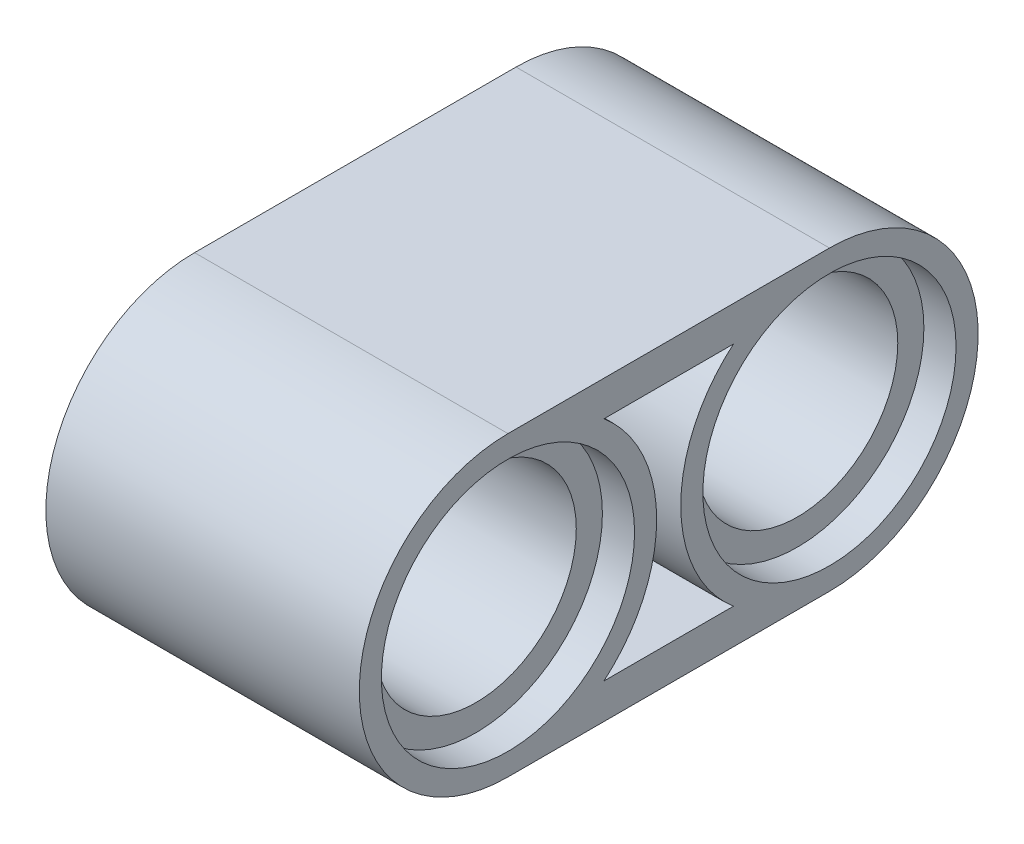
from build123d import *

# Parameters (mm, degrees)
EXTRUDE_1_DEPTH          = 7.8
CUT_EXTRUDE_1_DEPTH      = 12.568059474
CUT_EXTRUDE_1_DEPTH_BACK = 12.568059474
SKETCH_2_3_R             = 2.5
SKETCH_2_6_R             = 3.15
CUT_EXTRUDE_6_DEPTH      = 1
CUT_EXTRUDE_START        = -2
CUT_EXTRUDE_7_DEPTH      = 2
CUT_EXTRUDE_START_2      = -7.8
CUT_EXTRUDE_8_DEPTH      = 2


with BuildPart() as part:
    # 草图2 → 凸台-拉伸1 (new body)
    with BuildSketch(Plane(origin=(0, 0, 0), x_dir=(0, 0, -1), z_dir=(1, 0, 0))):
        with BuildLine():
            Line((-4, 3.7), (4, 3.7))
            ThreePointArc((4, 3.7), (7.7, 0), (4, -3.7))
            Line((4, -3.7), (-4, -3.7))
            ThreePointArc((-4, -3.7), (-7.7, 0), (-4, 3.7))
        make_face()
    extrude(amount=EXTRUDE_1_DEPTH)

    # 草图2<3> → 切除-拉伸1 (cut, two sides: drawn at the far end of the back side and taken through both)
    with BuildSketch(Plane(origin=(0, 0, 0), x_dir=(0, 0, -1), z_dir=(1, 0, 0)).offset(-CUT_EXTRUDE_1_DEPTH_BACK)):
        with Locations((-4, 0)):
            Circle(SKETCH_2_3_R)
        with Locations((4, 0)):
            Circle(SKETCH_2_3_R)
    extrude(amount=CUT_EXTRUDE_1_DEPTH + CUT_EXTRUDE_1_DEPTH_BACK, mode=Mode.SUBTRACT)

    # 草图2<6> → 切除-拉伸6 (cut)
    with BuildSketch(Plane(origin=(0, 0, 0), x_dir=(0, 0, -1), z_dir=(1, 0, 0))):
        with Locations((-4, 0)):
            Circle(SKETCH_2_6_R)
        with Locations((4, 0)):
            Circle(SKETCH_2_6_R)
    cut_extrude_6 = extrude(amount=CUT_EXTRUDE_6_DEPTH, mode=Mode.SUBTRACT)

    # 镜向1: 切除-拉伸6 across plane
    add(cut_extrude_6.mirror(Plane(origin=(4, 0, 0), x_dir=(0, 0, 1), z_dir=(1, 0, 0))), mode=Mode.SUBTRACT)

    # 草图3 → 切除-拉伸7 (cut)
    with BuildSketch(Plane(origin=(7.8, 0, 0), x_dir=(0, 0, -1), z_dir=(1, 0, 0)).offset(CUT_EXTRUDE_START)):
        with BuildLine():
            Line((1.610570152, 2.825), (-1.610570152, 2.825))
            ThreePointArc((-1.610570152, 2.825), (-0.643596386, 1.557098192), (-0.3, 0))
            ThreePointArc((-0.3, 0), (-0.643596386, -1.557098192), (-1.610570152, -2.825))
            Line((-1.610570152, -2.825), (1.610570152, -2.825))
            ThreePointArc((1.610570152, -2.825), (0.3, 0), (1.610570152, 2.825))
        make_face()
    extrude(amount=CUT_EXTRUDE_7_DEPTH, mode=Mode.SUBTRACT)

    # 草图3<3> → 切除-拉伸8 (cut)
    with BuildSketch(Plane(origin=(7.8, 0, 0), x_dir=(0, 0, -1), z_dir=(1, 0, 0)).offset(CUT_EXTRUDE_START_2)):
        with BuildLine():
            Line((1.610570152, 2.825), (-1.610570152, 2.825))
            ThreePointArc((-1.610570152, 2.825), (-0.643596386, 1.557098192), (-0.3, 0))
            ThreePointArc((-0.3, 0), (-0.643596386, -1.557098192), (-1.610570152, -2.825))
            Line((-1.610570152, -2.825), (1.610570152, -2.825))
            ThreePointArc((1.610570152, -2.825), (0.3, 0), (1.610570152, 2.825))
        make_face()
    extrude(amount=CUT_EXTRUDE_8_DEPTH, mode=Mode.SUBTRACT)


solid = part.part
